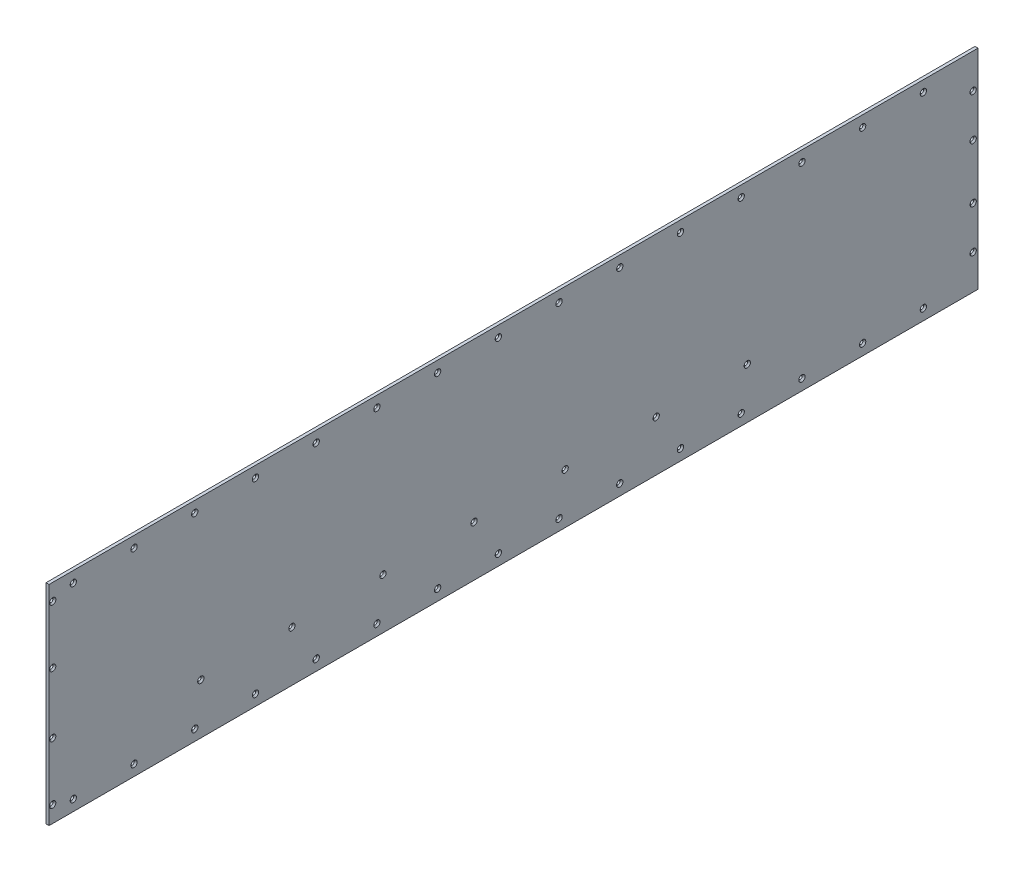
from build123d import *

# Parameters (mm, degrees)
SKETCH1_W                                            = 1530
SKETCH1_H                                            = 344
BOSS_EXTRUDE1_DEPTH                                  = 6
FASE1_SIZE                                           = 1
CSK_FOR_M5_COUNTERSUNK_RAISED_HEAD_SCREW_D           = 5.5
CSK_FOR_M5_COUNTERSUNK_RAISED_HEAD_SCREW_CSINK_D     = 10.4
CSK_FOR_M5_COUNTERSUNK_RAISED_HEAD_SCREW_CSINK_ANGLE = 90
CSK_FOR_M5_COUNTERSUNK_RAISED_HEAD_S_2_D             = 5.5
CSK_FOR_M5_COUNTERSUNK_RAISED_HEAD_S_2_CSINK_D       = 10.4
CSK_FOR_M5_COUNTERSUNK_RAISED_HEAD_S_2_CSINK_ANGLE   = 90
LPATTERN1_COUNT                                      = 15
LPATTERN1_PITCH                                      = 100
SPIEGELN1_COPY_1_D                                   = 5.5
SPIEGELN1_COPY_1_CSINK_D                             = 10.4
SPIEGELN1_COPY_1_CSINK_ANGLE                         = 90
SPIEGELN1_COPY_2_D                                   = 5.5
SPIEGELN1_COPY_2_CSINK_D                             = 10.4
SPIEGELN1_COPY_2_CSINK_ANGLE                         = 90
SPIEGELN1_COPY_3_D                                   = 5.5
SPIEGELN1_COPY_3_CSINK_D                             = 10.4
SPIEGELN1_COPY_3_CSINK_ANGLE                         = 90
SPIEGELN1_COPY_4_D                                   = 5.5
SPIEGELN1_COPY_4_CSINK_D                             = 10.4
SPIEGELN1_COPY_4_CSINK_ANGLE                         = 90
SPIEGELN1_COPY_5_D                                   = 5.5
SPIEGELN1_COPY_5_CSINK_D                             = 10.4
SPIEGELN1_COPY_5_CSINK_ANGLE                         = 90
SPIEGELN1_COPY_6_D                                   = 5.5
SPIEGELN1_COPY_6_CSINK_D                             = 10.4
SPIEGELN1_COPY_6_CSINK_ANGLE                         = 90
SPIEGELN1_COPY_7_D                                   = 5.5
SPIEGELN1_COPY_7_CSINK_D                             = 10.4
SPIEGELN1_COPY_7_CSINK_ANGLE                         = 90
SPIEGELN1_COPY_8_D                                   = 5.5
SPIEGELN1_COPY_8_CSINK_D                             = 10.4
SPIEGELN1_COPY_8_CSINK_ANGLE                         = 90
SPIEGELN1_COPY_9_D                                   = 5.5
SPIEGELN1_COPY_9_CSINK_D                             = 10.4
SPIEGELN1_COPY_9_CSINK_ANGLE                         = 90
SPIEGELN1_COPY_10_D                                  = 5.5
SPIEGELN1_COPY_10_CSINK_D                            = 10.4
SPIEGELN1_COPY_10_CSINK_ANGLE                        = 90
SPIEGELN1_COPY_11_D                                  = 5.5
SPIEGELN1_COPY_11_CSINK_D                            = 10.4
SPIEGELN1_COPY_11_CSINK_ANGLE                        = 90
SPIEGELN1_COPY_12_D                                  = 5.5
SPIEGELN1_COPY_12_CSINK_D                            = 10.4
SPIEGELN1_COPY_12_CSINK_ANGLE                        = 90
SPIEGELN1_COPY_13_D                                  = 5.5
SPIEGELN1_COPY_13_CSINK_D                            = 10.4
SPIEGELN1_COPY_13_CSINK_ANGLE                        = 90
SPIEGELN1_COPY_14_D                                  = 5.5
SPIEGELN1_COPY_14_CSINK_D                            = 10.4
SPIEGELN1_COPY_14_CSINK_ANGLE                        = 90
FORMSENKUNG_FUR_M5_LINSENSENKSCHRAUBE_MI_D           = 5.5
FORMSENKUNG_FUR_M5_LINSENSENKSCHRAUBE_MI_CSINK_D     = 10.4
FORMSENKUNG_FUR_M5_LINSENSENKSCHRAUBE_MI_CSINK_ANGLE = 90
LINEARES_MUSTER1_COUNT                               = 7
LINEARES_MUSTER1_PITCH                               = 150


with BuildPart() as part:
    # Sketch1 → Boss-Extrude1 (new body)
    with BuildSketch(Plane(origin=(0, 0, 0), x_dir=(0, 0, -1), z_dir=(1, 0, 0))):
        Rectangle(SKETCH1_W, SKETCH1_H)
    extrude(amount=BOSS_EXTRUDE1_DEPTH)

    # Fase1
    fase1_edges = [part.edges().sort_by_distance(p)[0] for p in [
        (0, 172, 0),
        (0, 0, -765),
        (0, -172, 0),
        (0, 0, 765),
    ]]
    chamfer(fase1_edges, length=FASE1_SIZE)

    # CSK for M5 Countersunk Raised Head Screw (through all)
    with Locations(Plane(origin=(6, 0, 0), x_dir=(0, 0, -1), z_dir=(1, 0, 0))):
        with Locations((757, 115), (757, 45), (-759, 145), (-759, 50)):
            csk_for_m5_countersunk_raised_head_screw = CounterSinkHole(CSK_FOR_M5_COUNTERSUNK_RAISED_HEAD_SCREW_D / 2, CSK_FOR_M5_COUNTERSUNK_RAISED_HEAD_SCREW_CSINK_D / 2, counter_sink_angle=CSK_FOR_M5_COUNTERSUNK_RAISED_HEAD_SCREW_CSINK_ANGLE)

    # CSK for M5 Countersunk Raised Head S 2 (through all)
    with Locations(Plane(origin=(6, 0, 0), x_dir=(0, 0, -1), z_dir=(1, 0, 0))):
        with Locations((-725, 154)):
            csk_for_m5_countersunk_raised_head_s_2 = CounterSinkHole(CSK_FOR_M5_COUNTERSUNK_RAISED_HEAD_S_2_D / 2, CSK_FOR_M5_COUNTERSUNK_RAISED_HEAD_S_2_CSINK_D / 2, counter_sink_angle=CSK_FOR_M5_COUNTERSUNK_RAISED_HEAD_S_2_CSINK_ANGLE)

    # LPattern1: CSK for M5 Countersunk Raised Head S 2 ×15
    with Locations(*[(0, 0, -i * LPATTERN1_PITCH) for i in range(1, LPATTERN1_COUNT)]):
        add(csk_for_m5_countersunk_raised_head_s_2, mode=Mode.SUBTRACT)

    # Spiegeln1: CSK for M5 Countersunk Raised Head Screw, CSK for M5 Countersunk Raised Head S 2 across plane
    add(csk_for_m5_countersunk_raised_head_screw.mirror(Plane.ZX), mode=Mode.SUBTRACT)
    add(csk_for_m5_countersunk_raised_head_s_2.mirror(Plane.ZX), mode=Mode.SUBTRACT)

    # Spiegeln1 copy 1 (through all)
    with Locations(Plane(origin=(6, 0, -100), x_dir=(0, 0, -1), z_dir=(1, 0, 0))):
        with Locations((-725, -154)):
            CounterSinkHole(SPIEGELN1_COPY_1_D / 2, SPIEGELN1_COPY_1_CSINK_D / 2, counter_sink_angle=SPIEGELN1_COPY_1_CSINK_ANGLE)

    # Spiegeln1 copy 2 (through all)
    with Locations(Plane(origin=(6, 0, -200), x_dir=(0, 0, -1), z_dir=(1, 0, 0))):
        with Locations((-725, -154)):
            CounterSinkHole(SPIEGELN1_COPY_2_D / 2, SPIEGELN1_COPY_2_CSINK_D / 2, counter_sink_angle=SPIEGELN1_COPY_2_CSINK_ANGLE)

    # Spiegeln1 copy 3 (through all)
    with Locations(Plane(origin=(6, 0, -300), x_dir=(0, 0, -1), z_dir=(1, 0, 0))):
        with Locations((-725, -154)):
            CounterSinkHole(SPIEGELN1_COPY_3_D / 2, SPIEGELN1_COPY_3_CSINK_D / 2, counter_sink_angle=SPIEGELN1_COPY_3_CSINK_ANGLE)

    # Spiegeln1 copy 4 (through all)
    with Locations(Plane(origin=(6, 0, -400), x_dir=(0, 0, -1), z_dir=(1, 0, 0))):
        with Locations((-725, -154)):
            CounterSinkHole(SPIEGELN1_COPY_4_D / 2, SPIEGELN1_COPY_4_CSINK_D / 2, counter_sink_angle=SPIEGELN1_COPY_4_CSINK_ANGLE)

    # Spiegeln1 copy 5 (through all)
    with Locations(Plane(origin=(6, 0, -500), x_dir=(0, 0, -1), z_dir=(1, 0, 0))):
        with Locations((-725, -154)):
            CounterSinkHole(SPIEGELN1_COPY_5_D / 2, SPIEGELN1_COPY_5_CSINK_D / 2, counter_sink_angle=SPIEGELN1_COPY_5_CSINK_ANGLE)

    # Spiegeln1 copy 6 (through all)
    with Locations(Plane(origin=(6, 0, -600), x_dir=(0, 0, -1), z_dir=(1, 0, 0))):
        with Locations((-725, -154)):
            CounterSinkHole(SPIEGELN1_COPY_6_D / 2, SPIEGELN1_COPY_6_CSINK_D / 2, counter_sink_angle=SPIEGELN1_COPY_6_CSINK_ANGLE)

    # Spiegeln1 copy 7 (through all)
    with Locations(Plane(origin=(6, 0, -700), x_dir=(0, 0, -1), z_dir=(1, 0, 0))):
        with Locations((-725, -154)):
            CounterSinkHole(SPIEGELN1_COPY_7_D / 2, SPIEGELN1_COPY_7_CSINK_D / 2, counter_sink_angle=SPIEGELN1_COPY_7_CSINK_ANGLE)

    # Spiegeln1 copy 8 (through all)
    with Locations(Plane(origin=(6, 0, -800), x_dir=(0, 0, -1), z_dir=(1, 0, 0))):
        with Locations((-725, -154)):
            CounterSinkHole(SPIEGELN1_COPY_8_D / 2, SPIEGELN1_COPY_8_CSINK_D / 2, counter_sink_angle=SPIEGELN1_COPY_8_CSINK_ANGLE)

    # Spiegeln1 copy 9 (through all)
    with Locations(Plane(origin=(6, 0, -900), x_dir=(0, 0, -1), z_dir=(1, 0, 0))):
        with Locations((-725, -154)):
            CounterSinkHole(SPIEGELN1_COPY_9_D / 2, SPIEGELN1_COPY_9_CSINK_D / 2, counter_sink_angle=SPIEGELN1_COPY_9_CSINK_ANGLE)

    # Spiegeln1 copy 10 (through all)
    with Locations(Plane(origin=(6, 0, -1000), x_dir=(0, 0, -1), z_dir=(1, 0, 0))):
        with Locations((-725, -154)):
            CounterSinkHole(SPIEGELN1_COPY_10_D / 2, SPIEGELN1_COPY_10_CSINK_D / 2, counter_sink_angle=SPIEGELN1_COPY_10_CSINK_ANGLE)

    # Spiegeln1 copy 11 (through all)
    with Locations(Plane(origin=(6, 0, -1100), x_dir=(0, 0, -1), z_dir=(1, 0, 0))):
        with Locations((-725, -154)):
            CounterSinkHole(SPIEGELN1_COPY_11_D / 2, SPIEGELN1_COPY_11_CSINK_D / 2, counter_sink_angle=SPIEGELN1_COPY_11_CSINK_ANGLE)

    # Spiegeln1 copy 12 (through all)
    with Locations(Plane(origin=(6, 0, -1200), x_dir=(0, 0, -1), z_dir=(1, 0, 0))):
        with Locations((-725, -154)):
            CounterSinkHole(SPIEGELN1_COPY_12_D / 2, SPIEGELN1_COPY_12_CSINK_D / 2, counter_sink_angle=SPIEGELN1_COPY_12_CSINK_ANGLE)

    # Spiegeln1 copy 13 (through all)
    with Locations(Plane(origin=(6, 0, -1300), x_dir=(0, 0, -1), z_dir=(1, 0, 0))):
        with Locations((-725, -154)):
            CounterSinkHole(SPIEGELN1_COPY_13_D / 2, SPIEGELN1_COPY_13_CSINK_D / 2, counter_sink_angle=SPIEGELN1_COPY_13_CSINK_ANGLE)

    # Spiegeln1 copy 14 (through all)
    with Locations(Plane(origin=(6, 0, -1400), x_dir=(0, 0, -1), z_dir=(1, 0, 0))):
        with Locations((-725, -154)):
            CounterSinkHole(SPIEGELN1_COPY_14_D / 2, SPIEGELN1_COPY_14_CSINK_D / 2, counter_sink_angle=SPIEGELN1_COPY_14_CSINK_ANGLE)

    # Formsenkung fur M5 Linsensenkschraube mit Schlitz1 (through all)
    with Locations(Plane(origin=(6, 0, 0), x_dir=(0, 0, -1), z_dir=(1, 0, 0))):
        with Locations((-515, -89)):
            formsenkung_fur_m5_linsensenkschraube_mi = CounterSinkHole(FORMSENKUNG_FUR_M5_LINSENSENKSCHRAUBE_MI_D / 2, FORMSENKUNG_FUR_M5_LINSENSENKSCHRAUBE_MI_CSINK_D / 2, counter_sink_angle=FORMSENKUNG_FUR_M5_LINSENSENKSCHRAUBE_MI_CSINK_ANGLE)

    # Lineares Muster1: Formsenkung fur M5 Linsensenkschraube mit Schlitz1 ×7
    with Locations(*[(0, 0, -i * LINEARES_MUSTER1_PITCH) for i in range(1, LINEARES_MUSTER1_COUNT)]):
        add(formsenkung_fur_m5_linsensenkschraube_mi, mode=Mode.SUBTRACT)


solid = part.part
